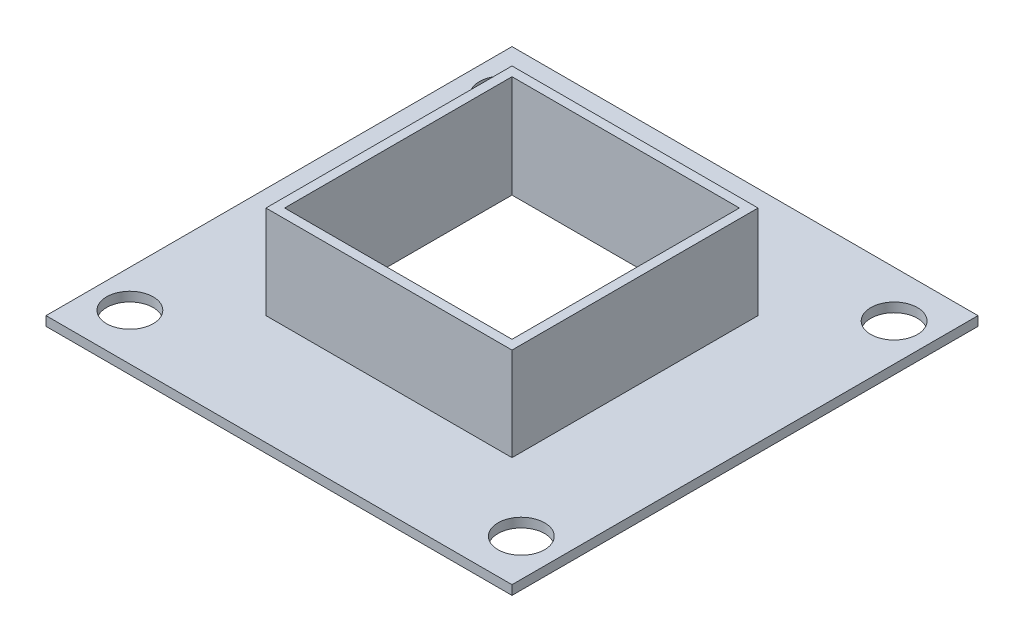
from build123d import *

# Parameters (mm, degrees)
SKETCH1_W           = 67.056
SKETCH1_H           = 67.056
SKETCH1_W_2         = 61.976
SKETCH1_H_2         = 61.976
BOSS_EXTRUDE1_DEPTH = 25.4
SKETCH3_W           = 127
SKETCH3_H           = 127
BOSS_EXTRUDE2_DEPTH = 2.54
SKETCH4_R           = 6.35
CUT_EXTRUDE1_DEPTH  = 94.3255592
SKETCH6_W           = 61.976
SKETCH6_H           = 61.976
CUT_EXTRUDE2_DEPTH  = 94.3255592


with BuildPart() as part:
    # Sketch1 → Boss-Extrude1 (new body)
    with BuildSketch(Plane(origin=(0, 0, 0), x_dir=(1, 0, 0), z_dir=(0, 1, 0))):
        Rectangle(SKETCH1_W, SKETCH1_H)
        Rectangle(SKETCH1_W_2, SKETCH1_H_2, mode=Mode.SUBTRACT)
    extrude(amount=BOSS_EXTRUDE1_DEPTH)

    # Sketch3 → Boss-Extrude2 (add)
    with BuildSketch(Plane.XZ):
        Rectangle(SKETCH3_W, SKETCH3_H)
    extrude(amount=BOSS_EXTRUDE2_DEPTH)

    # Sketch4 → Cut-Extrude1 (cut, through all)
    with BuildSketch(Plane(origin=(0, 0, 0), x_dir=(1, 0, 0), z_dir=(0, 1, 0))):
        with Locations(Location((-53.34, 50.8, 0), (0, 0, 270))):
            Circle(SKETCH4_R)
        with Locations(Location((53.34, 50.8, 0), (0, 0, 270))):
            Circle(SKETCH4_R)
        with Locations(Location((53.34, -50.8, 0), (0, 0, 270))):
            Circle(SKETCH4_R)
        with Locations(Location((-53.34, -50.8, 0), (0, 0, 270))):
            Circle(SKETCH4_R)
    extrude(amount=-CUT_EXTRUDE1_DEPTH, mode=Mode.SUBTRACT)

    # Sketch6 → Cut-Extrude2 (cut, through all)
    with BuildSketch(Plane(origin=(0, 0, 0), x_dir=(1, 0, 0), z_dir=(0, 1, 0))):
        Rectangle(SKETCH6_W, SKETCH6_H)
    extrude(amount=-CUT_EXTRUDE2_DEPTH, mode=Mode.SUBTRACT)


solid = part.part
